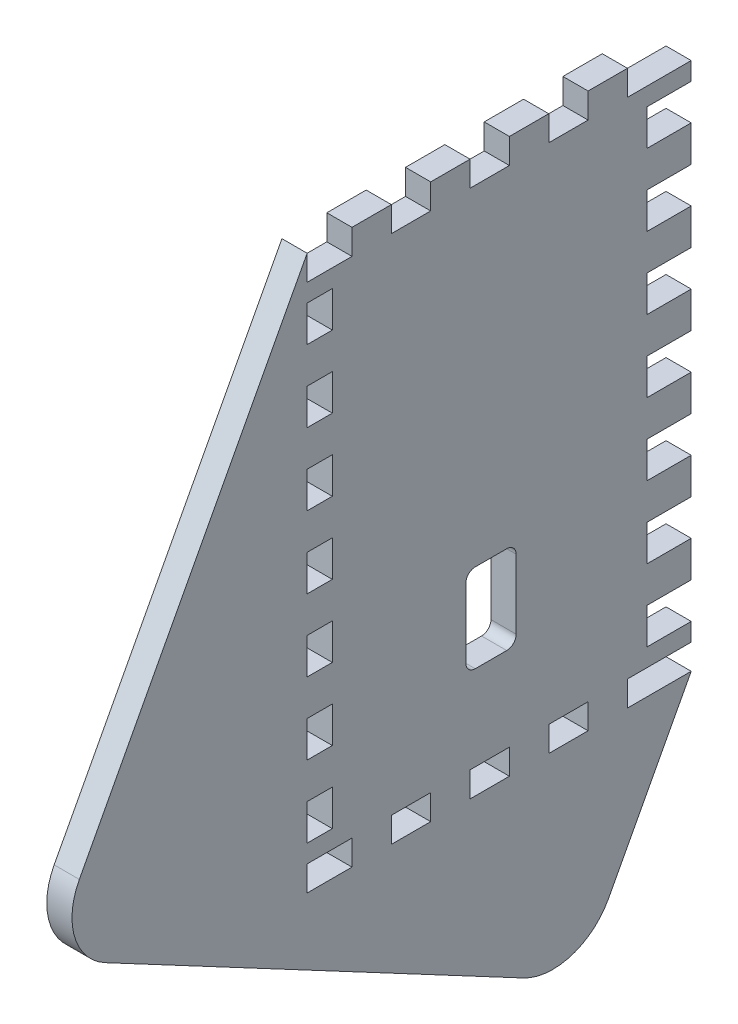
from build123d import *

# Parameters (mm, degrees)
SCHIZZO1_W                    = 50
SCHIZZO1_H                    = 80
ESTRUSIONE_ESTRUSIONE1_DEPTH  = 4
SCHIZZO2_W                    = 4
SCHIZZO2_H                    = 2.857142857
SCHIZZO2_W_2                  = 7
ESTRUSIONE_ESTRUSIONE2_DEPTH  = 4
SCHIZZO3_W                    = 4
SCHIZZO3_H                    = 5.714285715
SCHIZZO3_W_2                  = 7
ESTRUSIONE_ESTRUSIONE3_DEPTH  = 4
RIPETIZIONE_A_L1_COUNT        = 6
RIPETIZIONE_A_L1_PITCH        = 11.428571
SCHIZZO4_W                    = 6.25
SCHIZZO4_H                    = 4
ESTRUSIONE_ESTRUSIONE4_DEPTH  = 4
RIPETIZIONE_A_L2_COUNT        = 4
RIPETIZIONE_A_L2_PITCH        = 12.5
ESTRUSIONE_ESTRUSIONE5_DEPTH  = 4
RACCORDO1_R                   = 10
TAGLIO_ESTRUSIONE1_DEPTH      = 102.592322545
TAGLIO_ESTRUSIONE1_DEPTH_BACK = 102.592322545


with BuildPart() as part:
    # Schizzo1 → Estrusione-Estrusione1 (new body)
    with BuildSketch(Plane(origin=(0, 0, 0), x_dir=(0, 0, -1), z_dir=(1, 0, 0))):
        with Locations((25, 40)):
            Rectangle(SCHIZZO1_W, SCHIZZO1_H)
    extrude(amount=ESTRUSIONE_ESTRUSIONE1_DEPTH)

    # Schizzo2 → Estrusione-Estrusione2 (add)
    with BuildSketch(Plane(origin=(4, 0, 0), x_dir=(0, 0, -1), z_dir=(1, 0, 0))):
        with Locations((-2, 78.571428572)):
            Rectangle(SCHIZZO2_W, SCHIZZO2_H)
        with Locations((53.5, 78.571428572)):
            Rectangle(SCHIZZO2_W_2, SCHIZZO2_H)
        with Locations((53.5, 1.428571429)):
            Rectangle(SCHIZZO2_W_2, SCHIZZO2_H)
        with Locations((-2, 1.428571429)):
            Rectangle(SCHIZZO2_W, SCHIZZO2_H)
    extrude(amount=-ESTRUSIONE_ESTRUSIONE2_DEPTH)

    # Schizzo3 → Estrusione-Estrusione3 (add)
    with BuildSketch(Plane(origin=(4, 0, 0), x_dir=(0, 0, -1), z_dir=(1, 0, 0))):
        with Locations((-2, 68.571428572)):
            Rectangle(SCHIZZO3_W, SCHIZZO3_H)
        with Locations((53.5, 68.571428572)):
            Rectangle(SCHIZZO3_W_2, SCHIZZO3_H)
    estrusione_estrusione3 = extrude(amount=-ESTRUSIONE_ESTRUSIONE3_DEPTH)

    # Ripetizione a L1: Estrusione-Estrusione3 ×6
    with Locations(*[(0, -i * RIPETIZIONE_A_L1_PITCH, 0) for i in range(1, RIPETIZIONE_A_L1_COUNT)]):
        add(estrusione_estrusione3)

    # Schizzo4 → Estrusione-Estrusione4 (add)
    with BuildSketch(Plane(origin=(4, 0, 0), x_dir=(0, 0, -1), z_dir=(1, 0, 0))):
        with Locations((6.25, 82)):
            Rectangle(SCHIZZO4_W, SCHIZZO4_H)
        with Locations((6.25, -2)):
            Rectangle(SCHIZZO4_W, SCHIZZO4_H)
    estrusione_estrusione4 = extrude(amount=-ESTRUSIONE_ESTRUSIONE4_DEPTH)

    # Ripetizione a L2: Estrusione-Estrusione4 ×4
    with Locations(*[(0, 0, -i * RIPETIZIONE_A_L2_PITCH) for i in range(1, RIPETIZIONE_A_L2_COUNT)]):
        add(estrusione_estrusione4)

    # Schizzo5 → Estrusione-Estrusione5 (add)
    with BuildSketch(Plane(origin=(4, 0, 0), x_dir=(0, 0, -1), z_dir=(1, 0, 0))):
        Polygon((46.875, -4), (57, -4), (39.160080614, -37.552008529), (-44.872956134, 7.129149682), (-4, 84), (-4, 80), (-4, -4), align=None)
    extrude(amount=-ESTRUSIONE_ESTRUSIONE5_DEPTH)

    # Raccordo1
    raccordo1_edges = [part.edges().sort_by_distance(p)[0] for p in [
        (2, -37.552008529, -39.160080614),
        (2, 7.129149682, 44.872956134),
    ]]
    fillet(raccordo1_edges, radius=RACCORDO1_R)

    # Schizzo6 → Taglio-Estrusione1 (cut, two sides: drawn at the far end of the back side and taken through both)
    with BuildSketch(Plane(origin=(4, 0, 0), x_dir=(0, 0, -1), z_dir=(1, 0, 0)).offset(-TAGLIO_ESTRUSIONE1_DEPTH_BACK)):
        with BuildLine():
            Line((21.2, 26), (21.2, 15))
            ThreePointArc((21.2, 15), (21.639339828, 13.939339828), (22.7, 13.5))
            Line((22.7, 13.5), (27.7, 13.5))
            ThreePointArc((27.7, 13.5), (28.760660172, 13.939339828), (29.2, 15))
            Line((29.2, 15), (29.2, 26))
            ThreePointArc((29.2, 26), (28.760660172, 27.060660172), (27.7, 27.5))
            Line((27.7, 27.5), (22.7, 27.5))
            ThreePointArc((22.7, 27.5), (21.639339828, 27.060660172), (21.2, 26))
        make_face()
    extrude(amount=TAGLIO_ESTRUSIONE1_DEPTH + TAGLIO_ESTRUSIONE1_DEPTH_BACK, mode=Mode.SUBTRACT)


solid = part.part
